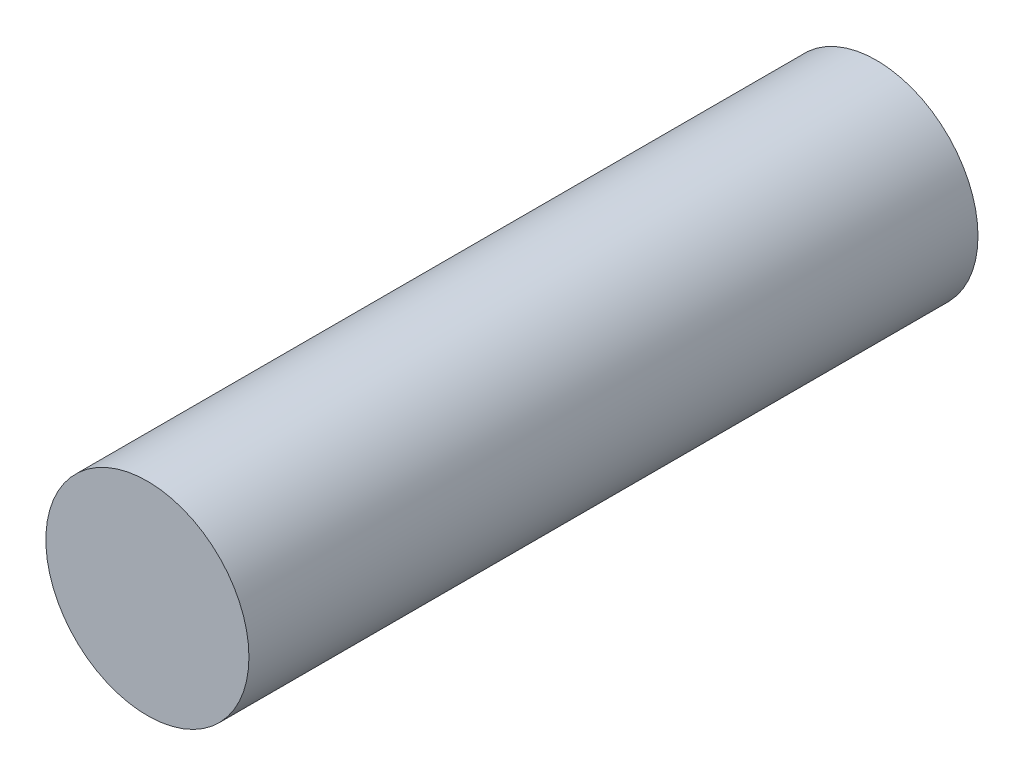
from build123d import *

# Parameters (mm, degrees)
SKETCH2_R           = 0.975
BOSS_EXTRUDE1_DEPTH = 7


with BuildPart() as part:
    # Sketch2 → Boss-Extrude1 (new body)
    with BuildSketch(Plane.XY):
        Circle(SKETCH2_R)
    extrude(amount=-BOSS_EXTRUDE1_DEPTH)


solid = part.part
